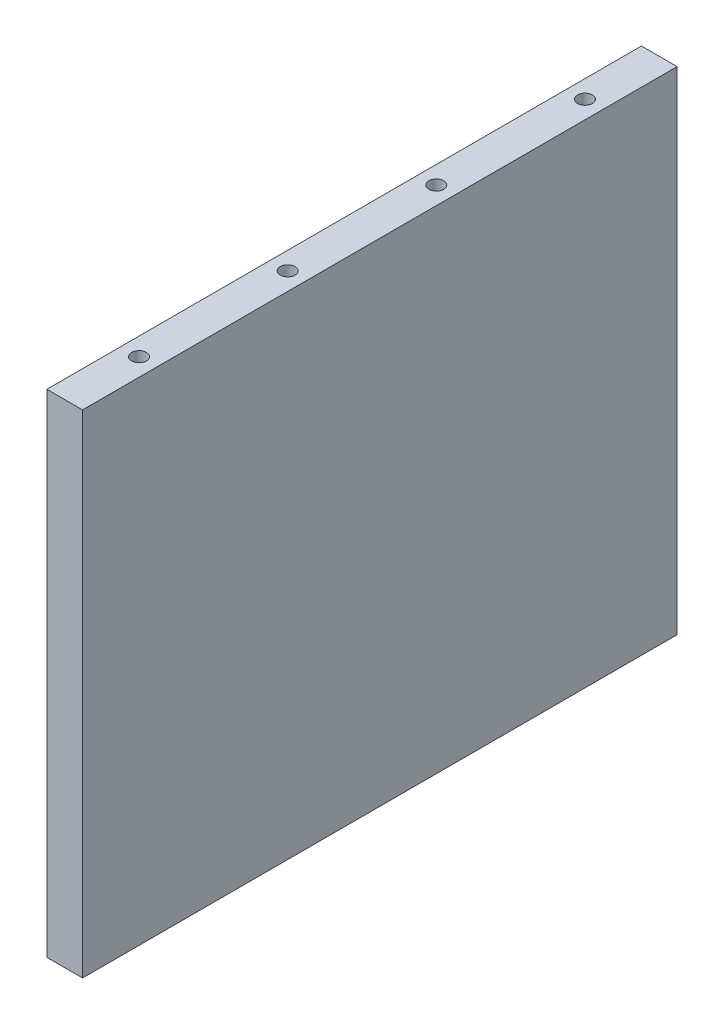
from build123d import *

# Parameters (mm, degrees)
BOSS_EXTRUDE1_DEPTH = 200
SKETCH2_R           = 2.5
CUT_EXTRUDE2_DEPTH  = 15
CUT_EXTRUDE3_START  = -15
SKETCH3_R           = 2.5
CUT_EXTRUDE3_DEPTH  = 15


with BuildPart() as part:
    # Sketch1 → Boss-Extrude1 (new body)
    with BuildSketch(Plane.XY):
        Polygon((-119, 208), (-131, 208), (-131, 42.5), (-119, 42.5), (-119, 165), align=None)
    extrude(amount=BOSS_EXTRUDE1_DEPTH)

    # Sketch2 → Cut-Extrude2 (cut)
    with BuildSketch(Plane(origin=(0, 208, 0), x_dir=(1, 0, 0), z_dir=(0, 1, 0))):
        with Locations(Location((-125, -25, 0), (0, 0, 270))):
            Circle(SKETCH2_R)
        with Locations(Location((-125, -75, 0), (0, 0, 270))):
            Circle(SKETCH2_R)
        with Locations(Location((-125, -125, 0), (0, 0, 270))):
            Circle(SKETCH2_R)
        with Locations(Location((-125, -175, 0), (0, 0, 270))):
            Circle(SKETCH2_R)
    extrude(amount=-CUT_EXTRUDE2_DEPTH, mode=Mode.SUBTRACT)

    # Sketch3 → Cut-Extrude3 (cut)
    with BuildSketch(Plane.XZ.offset(-42.5).offset(CUT_EXTRUDE3_START)):
        with Locations(Location((-125, 175, 0), (0, 0, 90))):
            Circle(SKETCH3_R)
        with Locations(Location((-125, 125, 0), (0, 0, 90))):
            Circle(SKETCH3_R)
        with Locations(Location((-125, 75, 0), (0, 0, 90))):
            Circle(SKETCH3_R)
        with Locations(Location((-125, 25, 0), (0, 0, 90))):
            Circle(SKETCH3_R)
    extrude(amount=CUT_EXTRUDE3_DEPTH, mode=Mode.SUBTRACT)


solid = part.part
